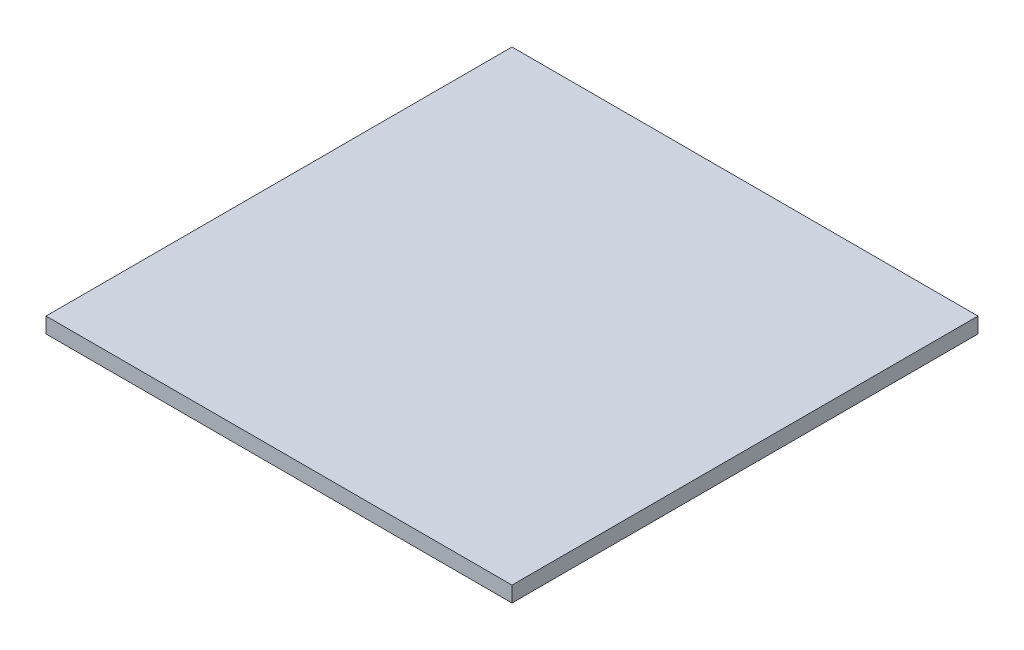
from build123d import *

# Parameters (mm, degrees)
SKETCH1_W           = 1524
SKETCH1_H           = 50.8
BOSS_EXTRUDE1_DEPTH = 762


with BuildPart() as part:
    # Sketch1 → Boss-Extrude1 (new, symmetric)
    with BuildSketch(Plane.XY):
        Rectangle(SKETCH1_W, SKETCH1_H)
    extrude(amount=BOSS_EXTRUDE1_DEPTH, both=True)


solid = part.part
